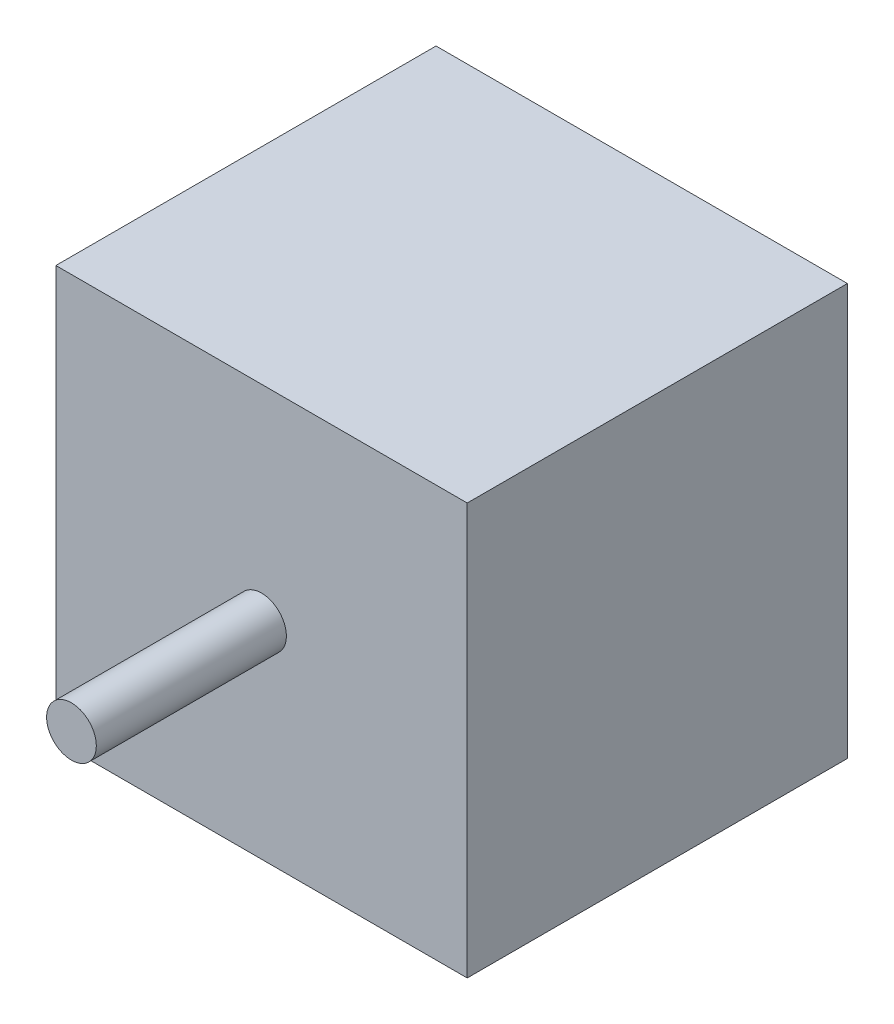
from build123d import *

# Parameters (mm, degrees)
SKETCH1_W           = 42.2
SKETCH1_H           = 42.2
BOSS_EXTRUDE1_DEPTH = 39
SKETCH2_R           = 2.55
BOSS_EXTRUDE2_DEPTH = 19.5


with BuildPart() as part:
    # Sketch1 → Boss-Extrude1 (new body)
    with BuildSketch(Plane.XY):
        with Locations((-21.1, -21.1)):
            Rectangle(SKETCH1_W, SKETCH1_H)
    extrude(amount=BOSS_EXTRUDE1_DEPTH)

    # Sketch2 → Boss-Extrude2 (add)
    with BuildSketch(Plane.XY.offset(39)):
        with Locations(Location((-21.1, -21.1, 0), (0, 0, 180))):
            Circle(SKETCH2_R)
    extrude(amount=BOSS_EXTRUDE2_DEPTH)


solid = part.part
